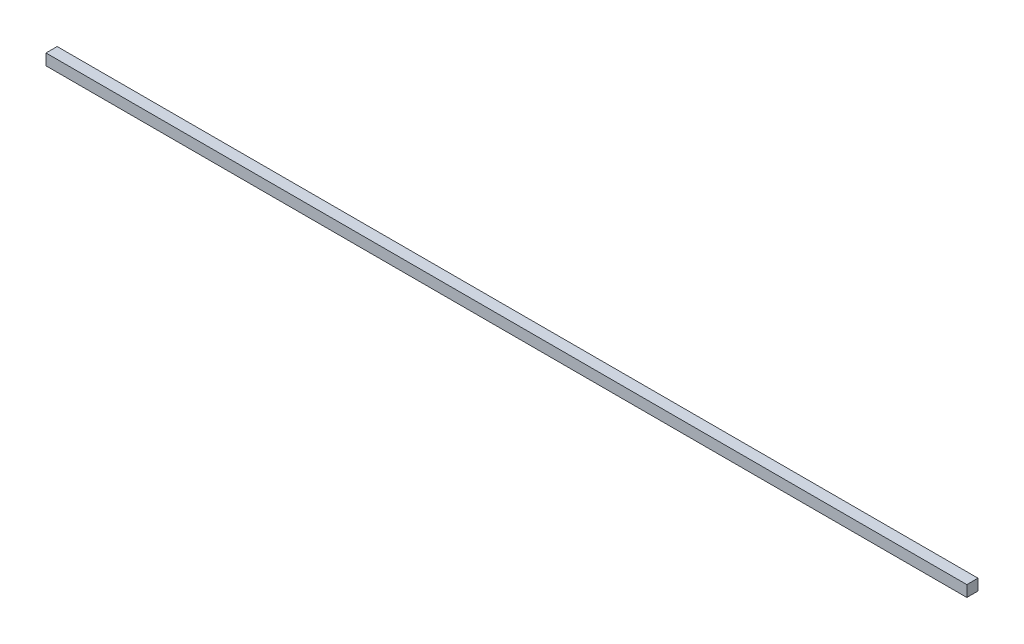
from build123d import *

# Parameters (mm, degrees)
FKAP_PIVOT_MILI_D8_1_START = 26
SKETCH1_W                  = 660
SKETCH1_H                  = 8
FKAP_PIVOT_MILI_D8_1_DEPTH = 8


with BuildPart() as part:
    # Sketch1 → FKAP_pivot_mili_D8_1 (new body)
    with BuildSketch(Plane.XY.offset(FKAP_PIVOT_MILI_D8_1_START)):
        with Locations((320, 6)):
            Rectangle(SKETCH1_W, SKETCH1_H)
    extrude(amount=FKAP_PIVOT_MILI_D8_1_DEPTH)


solid = part.part
